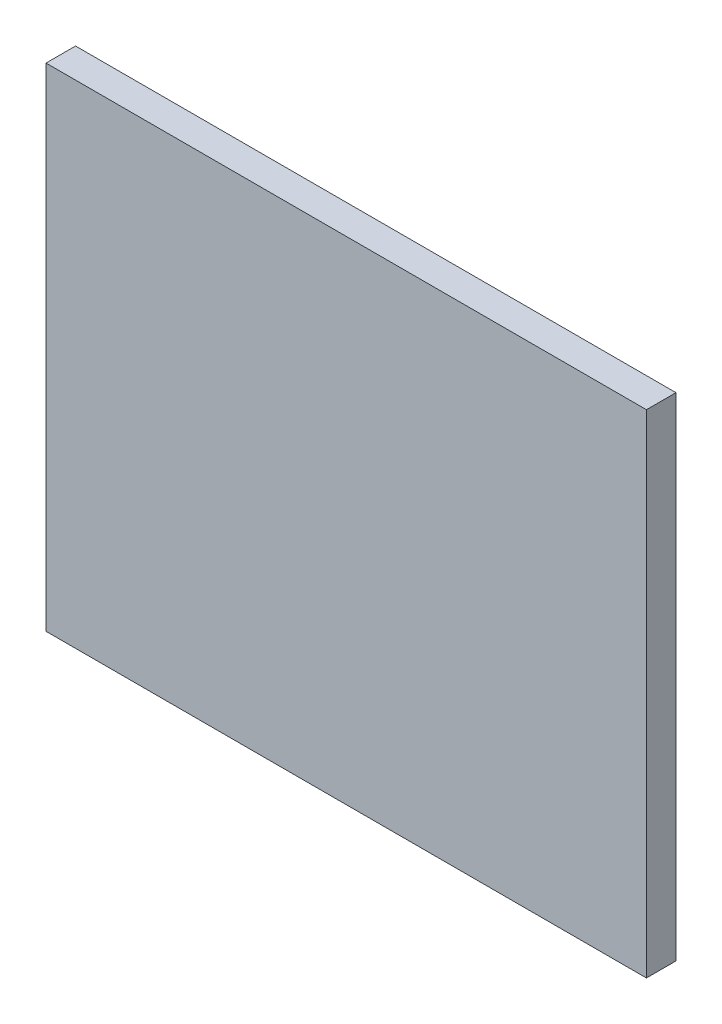
from build123d import *

# Parameters (mm, degrees)
SKETCH1_W           = 61
SKETCH1_H           = 50
BOSS_EXTRUDE1_DEPTH = 3


with BuildPart() as part:
    # Sketch1 → Boss-Extrude1 (new body)
    with BuildSketch(Plane.XY):
        Rectangle(SKETCH1_W, SKETCH1_H)
    extrude(amount=BOSS_EXTRUDE1_DEPTH)


solid = part.part
